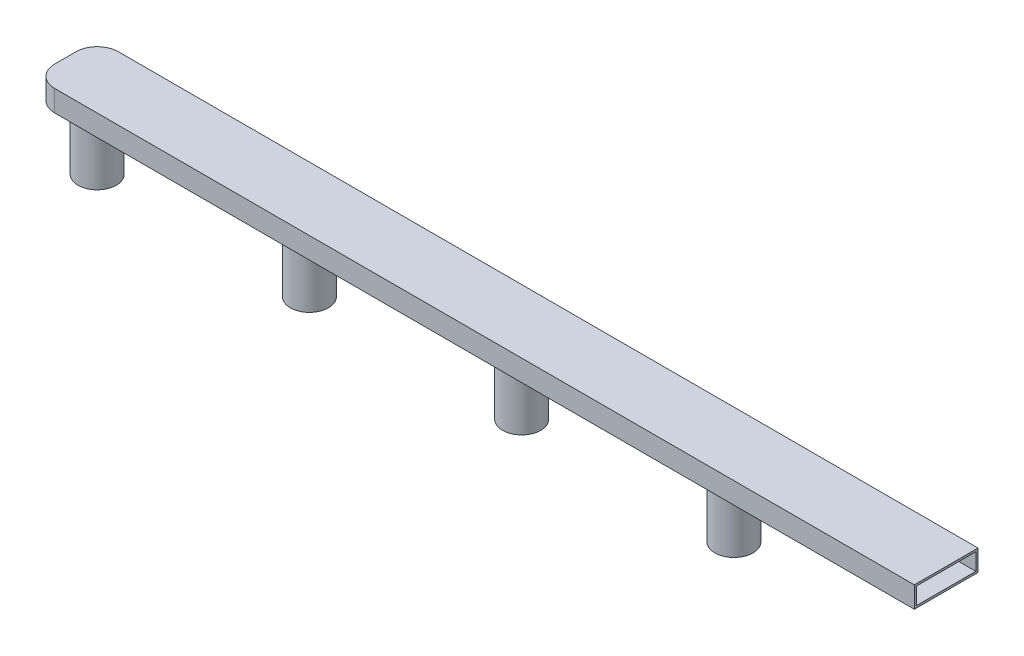
from build123d import *

# Parameters (mm, degrees)
SKETCH1_R             = 9
SKETCH1_R_2           = 6.5
BOSS_EXTRUDE1_DEPTH   = 30
BOSS_EXTRUDE1_2_DEPTH = 30
BOSS_EXTRUDE1_3_DEPTH = 30
BOSS_EXTRUDE1_4_DEPTH = 30
BOSS_EXTRUDE2_DEPTH   = 10
SHELL3_T              = -1


with BuildPart() as part:
    # Sketch1 → Boss-Extrude1 (new body)
    with BuildSketch(Plane(origin=(0, 0, 0), x_dir=(1, 0, 0), z_dir=(0, 1, 0))):
        with Locations(Location((-150, 0, 0), (0, 0, 270))):
            Circle(SKETCH1_R)
        with Locations(Location((-150, 0, 0), (0, 0, 270))):
            Circle(SKETCH1_R_2, mode=Mode.SUBTRACT)
    extrude(amount=-BOSS_EXTRUDE1_DEPTH)


with BuildPart() as body_2:
    # Sketch1 → Boss-Extrude1 2 (new body)
    with BuildSketch(Plane(origin=(0, 0, 0), x_dir=(1, 0, 0), z_dir=(0, 1, 0))):
        with Locations(Location((-50, 0, 0), (0, 0, 270))):
            Circle(SKETCH1_R)
        with Locations(Location((-50, 0, 0), (0, 0, 270))):
            Circle(SKETCH1_R_2, mode=Mode.SUBTRACT)
    extrude(amount=-BOSS_EXTRUDE1_2_DEPTH)


with BuildPart() as body_3:
    # Sketch1 → Boss-Extrude1 3 (new body)
    with BuildSketch(Plane(origin=(0, 0, 0), x_dir=(1, 0, 0), z_dir=(0, 1, 0))):
        with Locations(Location((50, 0, 0), (0, 0, 270))):
            Circle(SKETCH1_R)
        with Locations(Location((50, 0, 0), (0, 0, 270))):
            Circle(SKETCH1_R_2, mode=Mode.SUBTRACT)
    extrude(amount=-BOSS_EXTRUDE1_3_DEPTH)


with BuildPart() as body_4:
    # Sketch1 → Boss-Extrude1 4 (new body)
    with BuildSketch(Plane(origin=(0, 0, 0), x_dir=(1, 0, 0), z_dir=(0, 1, 0))):
        with Locations(Location((150, 0, 0), (0, 0, 270))):
            Circle(SKETCH1_R)
        with Locations(Location((150, 0, 0), (0, 0, 270))):
            Circle(SKETCH1_R_2, mode=Mode.SUBTRACT)
    extrude(amount=-BOSS_EXTRUDE1_4_DEPTH)


with BuildPart() as body_5:
    # Sketch2 → Boss-Extrude2 (new body)
    with BuildSketch(Plane(origin=(0, 0, 0), x_dir=(1, 0, 0), z_dir=(0, 1, 0))):
        with BuildLine():
            Line((-155, 15), (250, 15))
            Line((250, 15), (250, -15))
            Line((250, -15), (-155, -15))
            ThreePointArc((-155, -15), (-162.071067812, -12.071067812), (-165, -5))
            Line((-165, -5), (-165, 5))
            ThreePointArc((-165, 5), (-162.071067812, 12.071067812), (-155, 15))
        make_face()
    extrude(amount=BOSS_EXTRUDE2_DEPTH)

    # Shell3
    shell3_openings = [body_5.faces().sort_by_distance(p)[0] for p in [
        (250, 5, 0),
    ]]
    offset(amount=SHELL3_T, openings=shell3_openings, kind=Kind.INTERSECTION)


solid = Compound([part.part, body_2.part, body_3.part, body_4.part, body_5.part])
